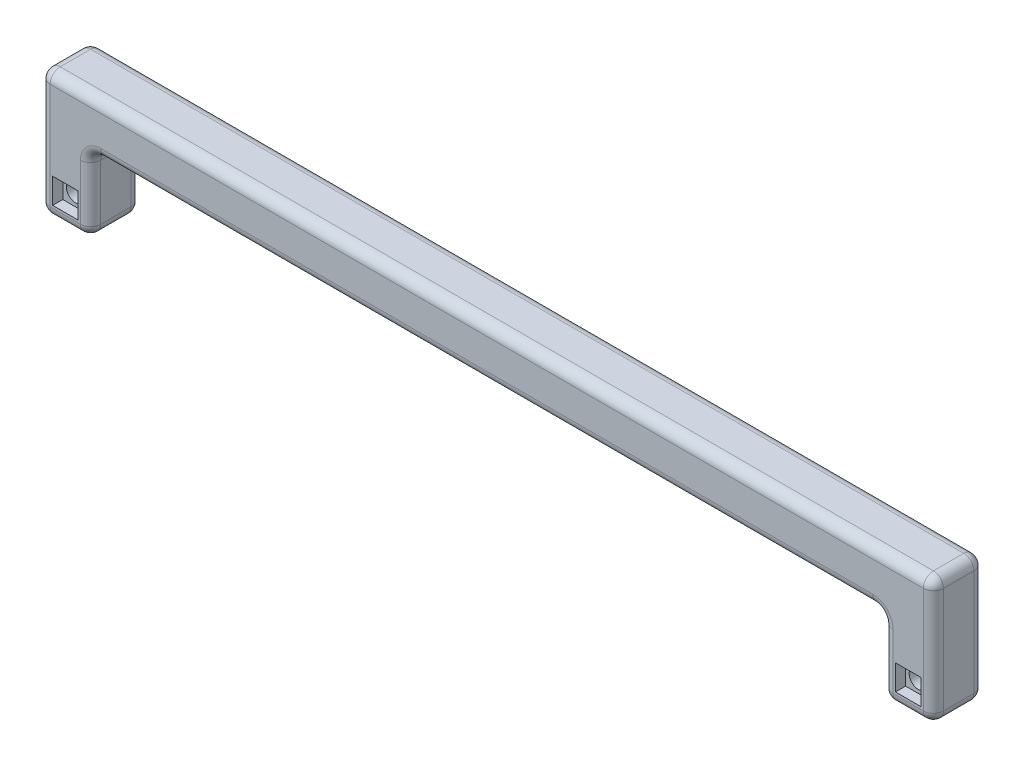
from build123d import *

# Parameters (mm, degrees)
SKETCH1_W           = 224.4725
SKETCH1_H           = 12.7
BOSS_EXTRUDE1_DEPTH = 12.7
SKETCH2_W           = 12.7
SKETCH2_H           = 12.7
BOSS_EXTRUDE2_DEPTH = 19.05
SKETCH3_R           = 2.286
CUT_EXTRUDE1_DEPTH  = 226.63708861
SKETCH4_W           = 6.35
SKETCH4_H           = 6.35
CUT_EXTRUDE2_DEPTH  = 2.54
FILLET1_R           = 2.54


with BuildPart() as part:
    # Sketch1 → Boss-Extrude1 (new body)
    with BuildSketch(Plane.XY):
        with Locations((112.23625, 6.35)):
            Rectangle(SKETCH1_W, SKETCH1_H)
    extrude(amount=BOSS_EXTRUDE1_DEPTH)

    # Sketch2 → Boss-Extrude2 (add)
    with BuildSketch(Plane.XZ):
        with Locations((6.35, 6.35)):
            Rectangle(SKETCH2_W, SKETCH2_H)
    boss_extrude2 = extrude(amount=BOSS_EXTRUDE2_DEPTH)

    # Sketch3 → Cut-Extrude1 (cut, through all)
    with BuildSketch(Plane.XY.offset(12.7)):
        with Locations((6.35, -12.7)):
            Circle(SKETCH3_R)
    cut_extrude1 = extrude(amount=-CUT_EXTRUDE1_DEPTH, mode=Mode.SUBTRACT)

    # Sketch4 → Cut-Extrude2 (cut)
    with BuildSketch(Plane.XY.offset(12.7)):
        with Locations((6.35, -12.7)):
            Rectangle(SKETCH4_W, SKETCH4_H)
    cut_extrude2 = extrude(amount=-CUT_EXTRUDE2_DEPTH, mode=Mode.SUBTRACT)

    # Mirror1: Boss-Extrude2, Cut-Extrude1, Cut-Extrude2 across plane
    add(boss_extrude2.mirror(Plane.ZY.offset(-112.23625)))
    add(cut_extrude1.mirror(Plane.ZY.offset(-112.23625)), mode=Mode.SUBTRACT)
    add(cut_extrude2.mirror(Plane.ZY.offset(-112.23625)), mode=Mode.SUBTRACT)

    # Fillet1
    fillet1_edges = [part.edges().sort_by_distance(p)[0] for p in [
        (224.4725, -3.175, 12.7),
        (112.23625, 0, 0),
        (112.23625, 0, 12.7),
        (12.7, 0, 6.35),
        (112.23625, 12.7, 12.7),
        (12.7, -9.525, 0),
        (12.7, -9.525, 12.7),
        (0, -19.05, 6.35),
        (6.35, -19.05, 0),
        (12.7, -19.05, 6.35),
        (6.35, -19.05, 12.7),
        (0, -3.175, 12.7),
        (112.23625, 12.7, 0),
        (224.4725, -19.05, 6.35),
        (218.1225, -19.05, 12.7),
        (211.7725, -19.05, 6.35),
        (211.7725, -9.525, 12.7),
        (218.1225, -19.05, 0),
        (211.7725, -9.525, 0),
        (211.7725, 0, 6.35),
        (224.4725, -3.175, 0),
        (0, -3.175, 0),
        (0, 12.7, 6.35),
        (224.4725, 12.7, 6.35),
    ]]
    fillet(fillet1_edges, radius=FILLET1_R)


solid = part.part
